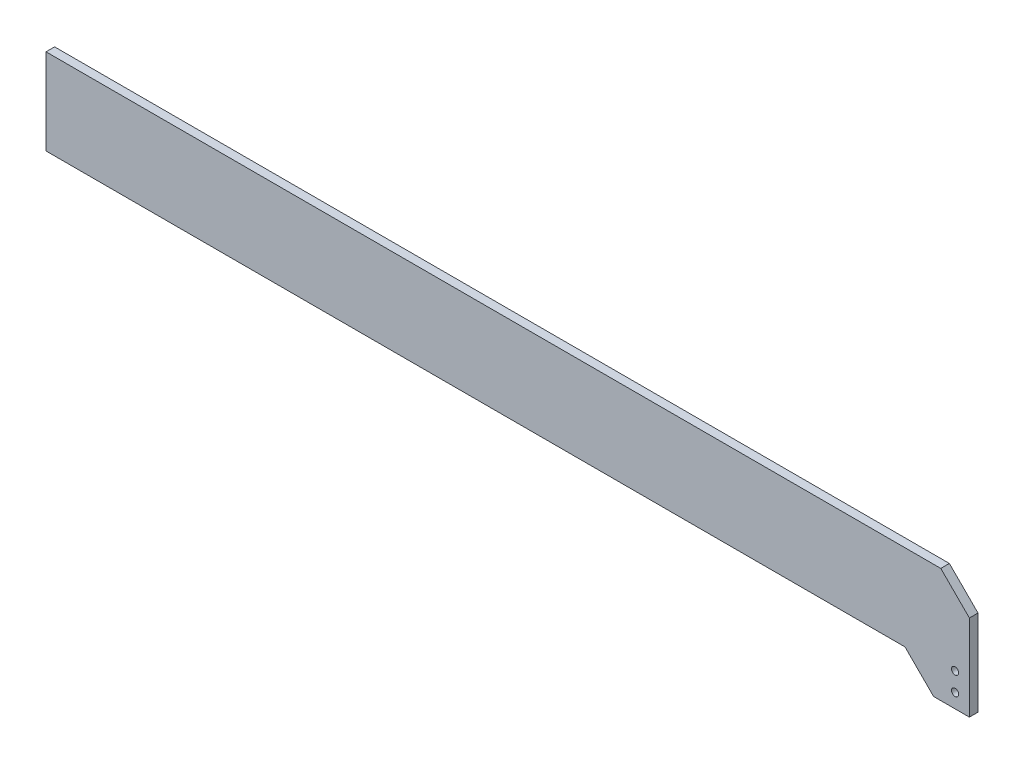
from build123d import *

# Parameters (mm, degrees)
SKETCH1_R           = 2.5
BOSS_EXTRUDE1_DEPTH = 6


with BuildPart() as part:
    # Sketch1 → Boss-Extrude1 (new body)
    with BuildSketch(Plane.XY):
        Polygon((257.640643246, 162.769630368), (277.640643246, 142.769630368), (277.640643246, 82.769630368), (252.640643246, 82.769630368), (232.640643246, 102.769630368), (-367.359356754, 102.769630368), (-367.359356754, 162.769630368), align=None)
        with Locations((267.640643246, 105.769630368)):
            Circle(SKETCH1_R, mode=Mode.SUBTRACT)
        with Locations((267.640643246, 92.769630368)):
            Circle(SKETCH1_R, mode=Mode.SUBTRACT)
    extrude(amount=BOSS_EXTRUDE1_DEPTH)


solid = part.part
